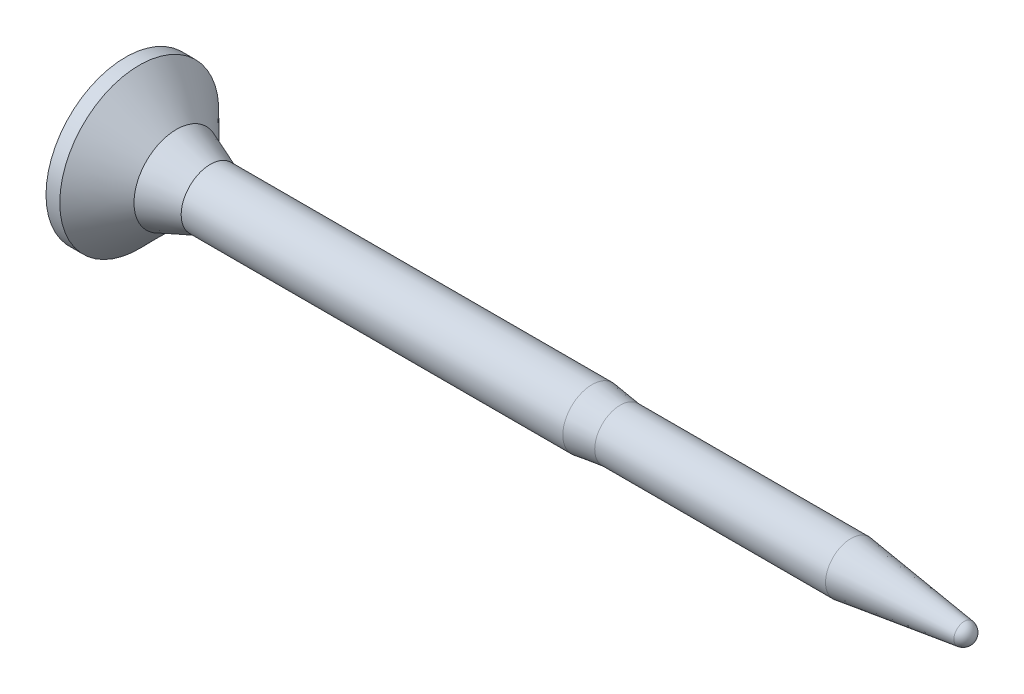
from build123d import *


with BuildPart() as part:
    # Sketch1 → Revolve1 (revolve)
    with BuildSketch(Plane.XY, mode=Mode.PRIVATE) as revolve1_sk:
        with BuildLine():
            Line((0, -4.7625), (0, 0))
            Line((0, 0), (50.8, 0))
            ThreePointArc((50.8, 0), (50.642418278, -0.418684593), (50.247884132, -0.629567487))
            Line((50.247884132, -0.629567487), (43.453994693, -1.524))
            Line((43.453994693, -1.524), (29.628156352, -1.524))
            Line((29.628156352, -1.524), (27.94, -1.74625))
            Line((27.94, -1.74625), (5.08, -1.74625))
            Line((5.08, -1.74625), (3.048, -2.54))
            Line((3.048, -2.54), (0.8255, -4.7625))
            Line((0.8255, -4.7625), (0, -4.7625))
        make_face()
    revolve(revolve1_sk.sketch.rotate(Axis((0, 0, 0), (1, 0, 0)), 270), axis=Axis((0, 0, 0), (1, 0, 0)))


solid = part.part
